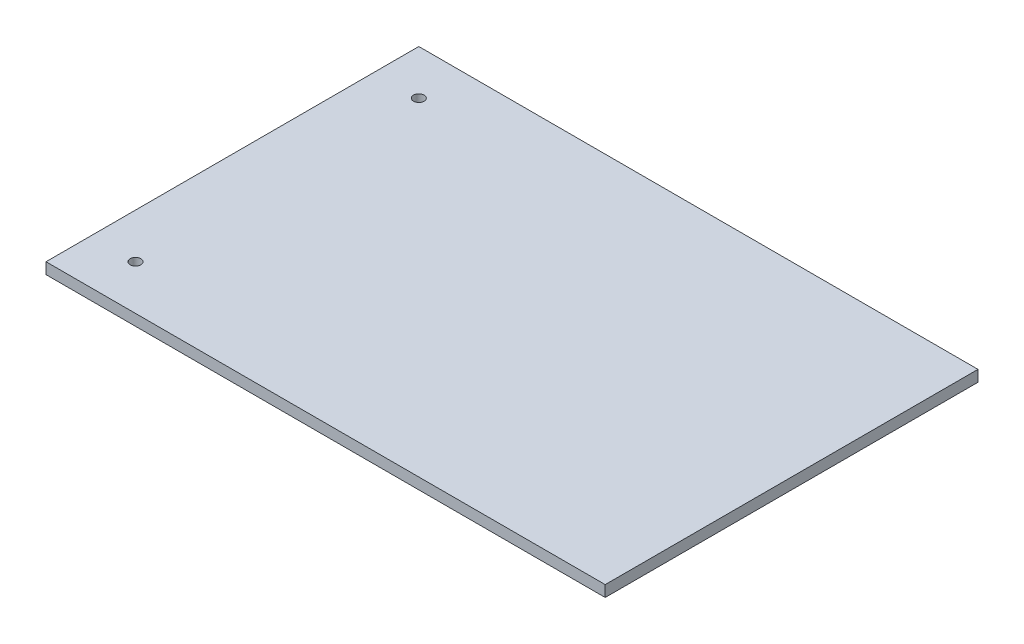
from build123d import *

# Parameters (mm, degrees)
SKETCH1_W           = 150
SKETCH1_H           = 100
BOSS_EXTRUDE1_DEPTH = 3
SKETCH2_R           = 1.425
CUT_EXTRUDE1_DEPTH  = 10
LPATTERN1_COUNT     = 2
LPATTERN1_PITCH     = 76


with BuildPart() as part:
    # Sketch1 → Boss-Extrude1 (new body)
    with BuildSketch(Plane(origin=(0, 0, 0), x_dir=(1, 0, 0), z_dir=(0, 1, 0))):
        Rectangle(SKETCH1_W, SKETCH1_H)
    extrude(amount=BOSS_EXTRUDE1_DEPTH)

    # Sketch2 → Cut-Extrude1 (cut)
    with BuildSketch(Plane(origin=(0, 3, 0), x_dir=(1, 0, 0), z_dir=(0, 1, 0))):
        with Locations(Location((-63, 38, 0), (0, 0, 270))):
            Circle(SKETCH2_R)
    cut_extrude1 = extrude(amount=-CUT_EXTRUDE1_DEPTH, mode=Mode.SUBTRACT)

    # LPattern1: Cut-Extrude1 ×2
    with Locations(*[(0, 0, i * LPATTERN1_PITCH) for i in range(1, LPATTERN1_COUNT)]):
        add(cut_extrude1, mode=Mode.SUBTRACT)


solid = part.part
